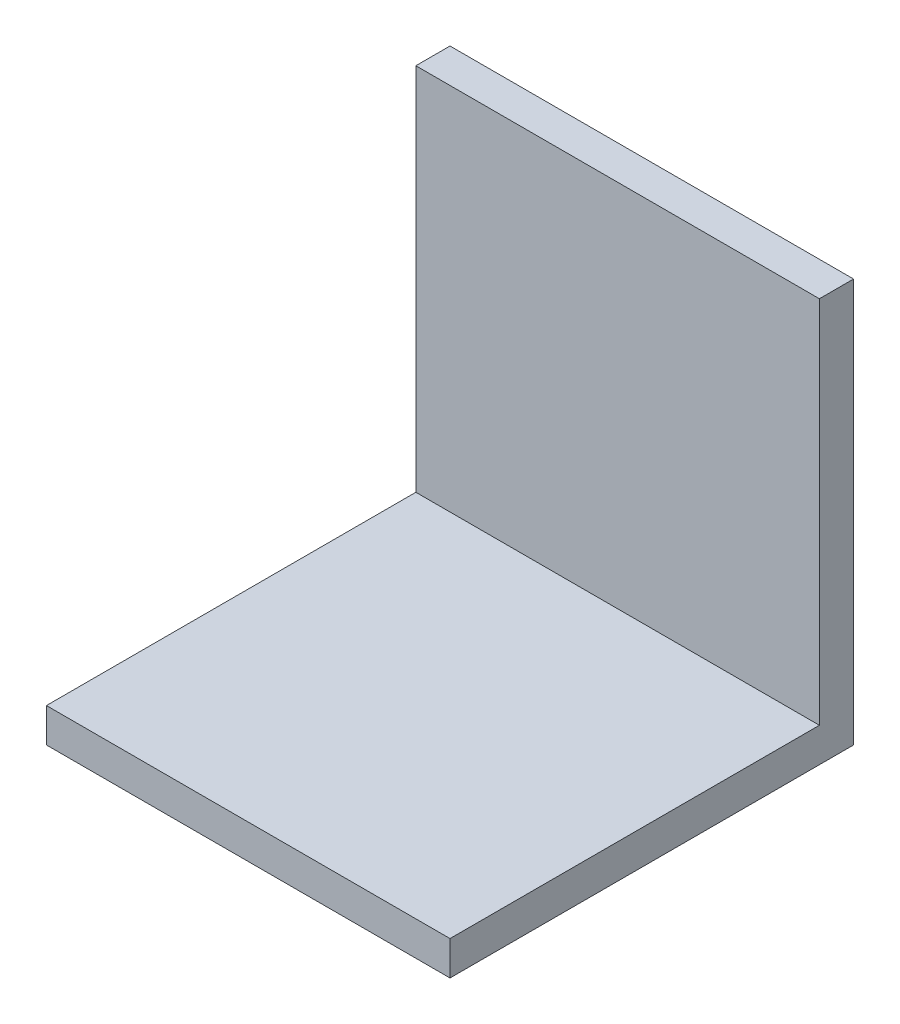
from build123d import *

# Parameters (mm, degrees)
SKETCH1_W           = 60
SKETCH1_H           = 60
BOSS_EXTRUDE1_DEPTH = 5.08
SKETCH2_W           = 60
SKETCH2_H           = 60
BOSS_EXTRUDE2_DEPTH = 5.08


with BuildPart() as part:
    # Sketch1 → Boss-Extrude1 (new body)
    with BuildSketch(Plane(origin=(0, 0, 0), x_dir=(1, 0, 0), z_dir=(0, 1, 0))):
        with Locations((30, 30)):
            Rectangle(SKETCH1_W, SKETCH1_H)
    extrude(amount=BOSS_EXTRUDE1_DEPTH)

    # Sketch2 → Boss-Extrude2 (add)
    with BuildSketch(Plane(origin=(0, 0, -60), x_dir=(-1, 0, 0), z_dir=(0, 0, -1))):
        with Locations((-30, 30)):
            Rectangle(SKETCH2_W, SKETCH2_H)
    extrude(amount=-BOSS_EXTRUDE2_DEPTH)


solid = part.part
